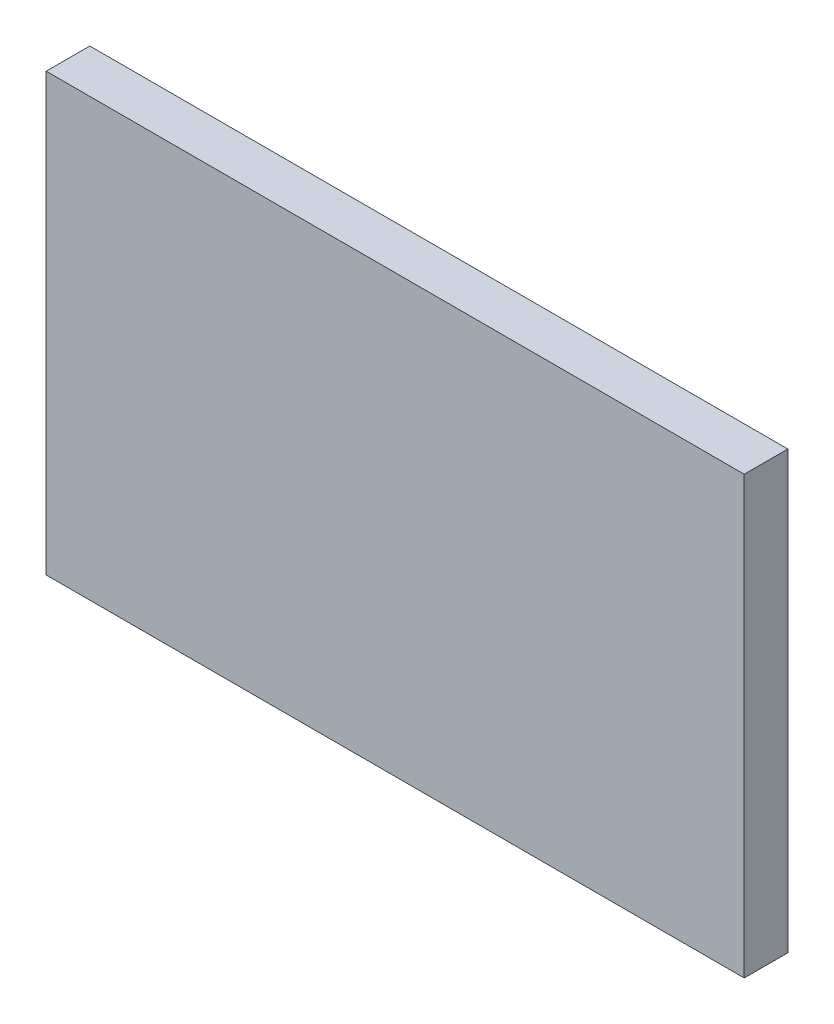
from build123d import *

# Parameters (mm, degrees)
ESQUISSE1_W        = 160
ESQUISSE1_H        = 100
BOSS_EXTRU_1_DEPTH = 10


with BuildPart() as part:
    # Esquisse1 → Boss.-Extru.1 (new body)
    with BuildSketch(Plane.XY):
        with Locations((40.980876509, -20.246127563)):
            Rectangle(ESQUISSE1_W, ESQUISSE1_H)
    extrude(amount=BOSS_EXTRU_1_DEPTH)


solid = part.part
